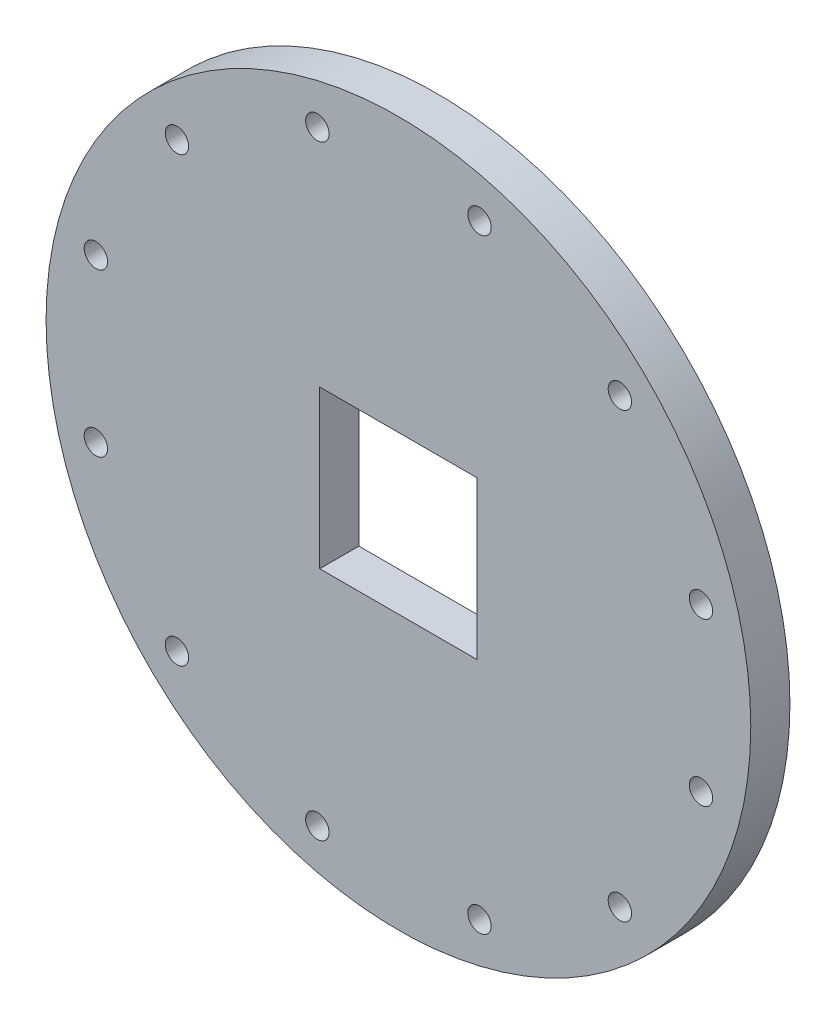
from build123d import *

# Parameters (mm, degrees)
SKETCH1_R             = 57.15
SKETCH1_W             = 25.527
SKETCH1_H             = 25.527
BOSS_EXTRUDE1_DEPTH   = 6.35
F_6_CLEARANCE_HOLE1_D = 3.7973
CIRPATTERN1_COUNT     = 12
SKETCH4_R             = 3.4925
CUT_EXTRUDE1_DEPTH    = 3.048
CIRPATTERN2_COUNT     = 12


with BuildPart() as part:
    # Sketch1 → Boss-Extrude1 (new body)
    with BuildSketch(Plane.XY):
        Circle(SKETCH1_R)
        Rectangle(SKETCH1_W, SKETCH1_H, mode=Mode.SUBTRACT)
    extrude(amount=BOSS_EXTRUDE1_DEPTH)

    # #6 Clearance Hole1 (through all)
    with Locations(Plane(origin=(0, 0, 0), x_dir=(-1, 0, 0), z_dir=(0, 0, -1))):
        with Locations((35.921024484, 35.921024484)):
            f_6_clearance_hole1 = Hole(F_6_CLEARANCE_HOLE1_D / 2)

    # CirPattern1: #6 Clearance Hole1 ×12 about axis
    cirpattern1_axis = Axis((0, 0, 0), (0, 0, 1))
    for i in range(1, CIRPATTERN1_COUNT):
        add(f_6_clearance_hole1.rotate(cirpattern1_axis, i * 360 / CIRPATTERN1_COUNT), mode=Mode.SUBTRACT)

    # Sketch4 → Cut-Extrude1 (cut)
    with BuildSketch(Plane(origin=(0, 0, 0), x_dir=(-1, 0, 0), z_dir=(0, 0, -1))):
        with Locations((35.921024484, 35.921024484)):
            Circle(SKETCH4_R)
    cut_extrude1 = extrude(amount=-CUT_EXTRUDE1_DEPTH, mode=Mode.SUBTRACT)

    # CirPattern2: Cut-Extrude1 ×12 about axis
    cirpattern2_axis = Axis((0, 0, 0), (0, 0, 1))
    for i in range(1, CIRPATTERN2_COUNT):
        add(cut_extrude1.rotate(cirpattern2_axis, i * 360 / CIRPATTERN2_COUNT), mode=Mode.SUBTRACT)


solid = part.part
